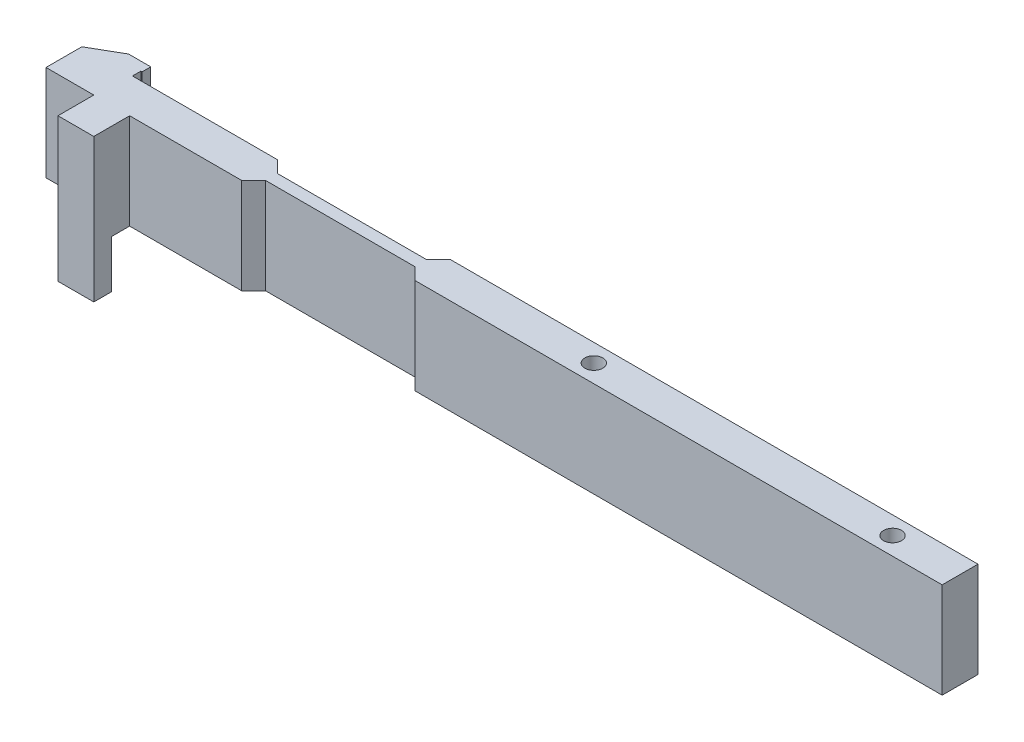
from build123d import *

# Parameters (mm, degrees)
EXTRUDE_1_DEPTH     = 16
SKETCH_3_R          = 1.5
CUT_EXTRUDE_1_DEPTH = 82.804645345
SKETCH_4_W          = 6
SKETCH_4_H          = 6
EXTRUDE_2_DEPTH     = 16
EXTRUDE_START       = -16
EXTRUDE_4_DEPTH     = 8


with BuildPart() as part:
    # Эскиз1 → Бобышка-Вытянуть1 (new body)
    with BuildSketch(Plane(origin=(0, 0, 0), x_dir=(1, 0, 0), z_dir=(0, 1, 0))):
        Polygon((0, 0), (-71.525936721, 0), (-71.525936721, 1.396480231), (-71.325936721, 1.396480231), (-71.325936721, 2.8586364), (-75.035652424, 2.8586364), (-80, -0.007531009), (-80, -6), (70, -6), (70, 0), align=None)
    extrude(amount=EXTRUDE_1_DEPTH)

    # Эскиз3 → Вырез-Вытянуть1 (cut, through all)
    with BuildSketch(Plane(origin=(0, 16, 0), x_dir=(1, 0, 0), z_dir=(0, 1, 0))):
        with Locations(Location((8.699103215, -3.003765504, 0), (0, 0, 270))):
            Circle(SKETCH_3_R)
        with Locations(Location((58.699103215, -3.003765504, 0), (0, 0, 270))):
            Circle(SKETCH_3_R)
        Polygon((-47.243192472, 0), (-45.239426968, -2.003765504), (-20.270391363, -2.003765504), (-18.266625858, 0), align=None)
        Polygon((-47.243192472, -6.007531009), (-18.266625858, -6.007531009), (-20.270391363, -4.003765504), (-45.239426968, -4.003765504), align=None)
    extrude(amount=-CUT_EXTRUDE_1_DEPTH, mode=Mode.SUBTRACT)

    # Эскиз4 → Бобышка-Вытянуть2 (add)
    with BuildSketch(Plane.XZ):
        with Locations((-69, 9)):
            Rectangle(SKETCH_4_W, SKETCH_4_H)
    extrude(amount=-EXTRUDE_2_DEPTH)

    # Эскиз5<2> → Бобышка-Вытянуть4 (add)
    with BuildSketch(Plane(origin=(0, 16, 0), x_dir=(1, 0, 0), z_dir=(0, 1, 0)).offset(EXTRUDE_START)):
        Polygon((-72, -12), (-72, -6), (-66, -9), (-66, -12), align=None)
    extrude(amount=-EXTRUDE_4_DEPTH)


solid = part.part
